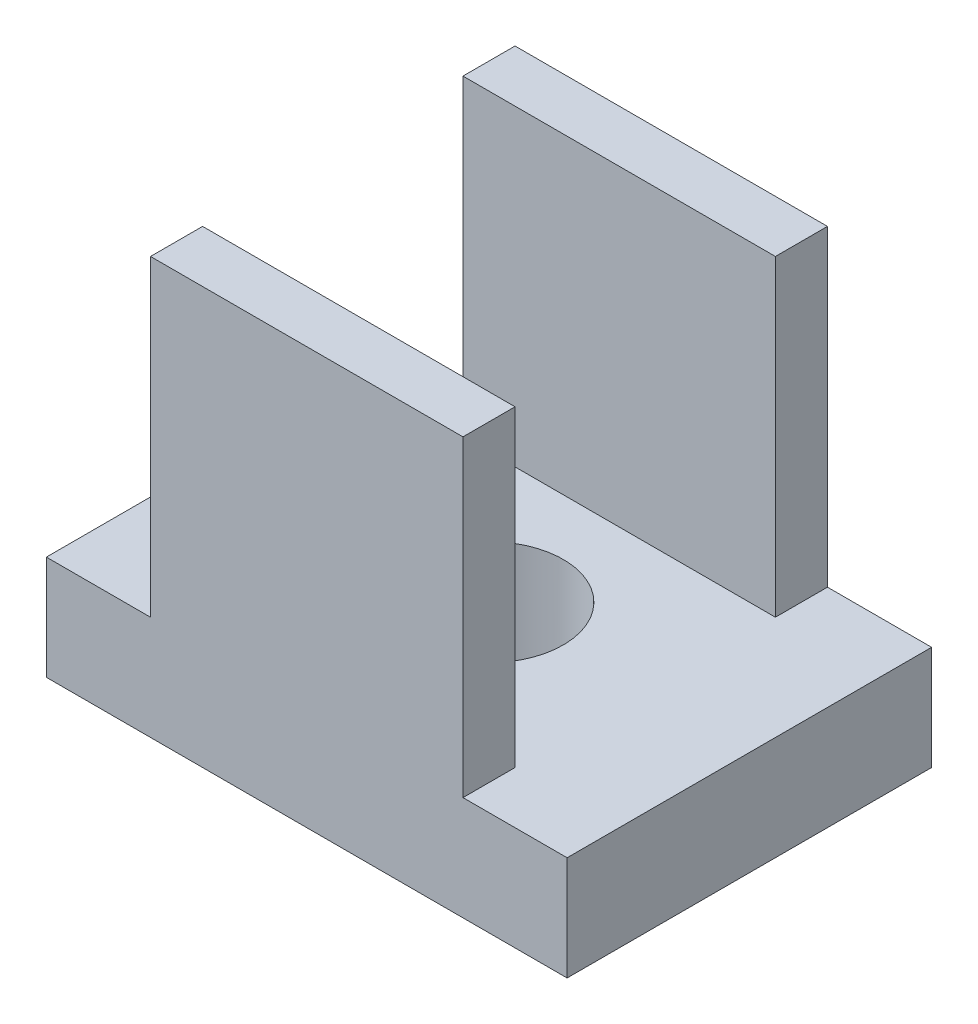
from build123d import *

# Parameters (mm, degrees)
SKETCH1_W           = 10
SKETCH1_H           = 7
BOSS_EXTRUDE1_DEPTH = 2
SKETCH2_R           = 1.425
CUT_EXTRUDE1_DEPTH  = 15
SKETCH4_W           = 6
SKETCH4_H           = 1
BOSS_EXTRUDE2_DEPTH = 6


with BuildPart() as part:
    # Sketch1 → Boss-Extrude1 (new body)
    with BuildSketch(Plane(origin=(0, 0, 0), x_dir=(1, 0, 0), z_dir=(0, 1, 0))):
        Rectangle(SKETCH1_W, SKETCH1_H)
    extrude(amount=BOSS_EXTRUDE1_DEPTH)

    # Sketch2 → Cut-Extrude1 (cut)
    with BuildSketch(Plane(origin=(0, 2, 0), x_dir=(1, 0, 0), z_dir=(0, 1, 0))):
        with Locations(Location((0, 0, 0), (0, 0, 270))):
            Circle(SKETCH2_R)
    extrude(amount=-CUT_EXTRUDE1_DEPTH, mode=Mode.SUBTRACT)

    # Sketch4 → Boss-Extrude2 (add)
    with BuildSketch(Plane(origin=(0, 2, 0), x_dir=(1, 0, 0), z_dir=(0, 1, 0))):
        with Locations((0, 3)):
            Rectangle(SKETCH4_W, SKETCH4_H)
        with Locations((0, -3)):
            Rectangle(SKETCH4_W, SKETCH4_H)
    extrude(amount=BOSS_EXTRUDE2_DEPTH)


solid = part.part
